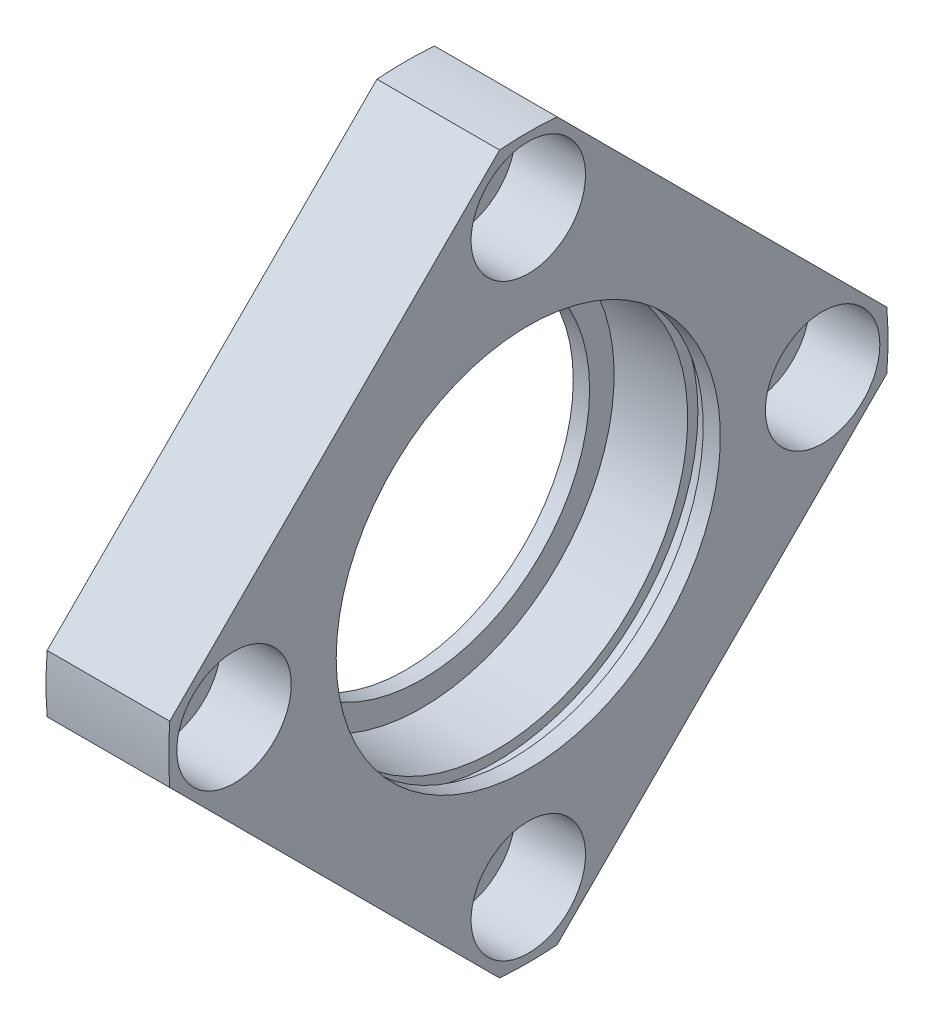
from build123d import *

# Parameters (mm, degrees)
DIAMETER_HOLE1_D     = 14
DIAMETER_HOLE1_DEPTH = 8.6
TAPPED_HOLE1_D       = 8.5
CUT_EXTRUDE1_DEPTH   = 65.007812023


with BuildPart() as part:
    # Sketch1 → Revolve1 (revolve)
    with BuildSketch(Plane.XY):
        Polygon((15, 44), (0, 44), (0, 20.5), (2, 20.5), (2, 23.5), (11, 23.5), (11, 24.75), (12.9, 24.75), (12.9, 23.5), (15, 23.5), align=None)
    revolve(axis=Axis((0, 0, 0), (1, 0, 0)))

    # Diameter Hole1
    with Locations(Plane(origin=(15, 0, 0), x_dir=(0, 0, -1), z_dir=(1, 0, 0))):
        with Locations((0, 36), (36, 0), (0, -36), (-36, 0)):
            Hole(DIAMETER_HOLE1_D / 2, depth=DIAMETER_HOLE1_DEPTH)

    # Tapped Hole1 (through all)
    with Locations(Plane(origin=(6.4, 0, 0), x_dir=(0, 0, -1), z_dir=(1, 0, 0))):
        with Locations((0, 36), (36, 0), (0, -36), (-36, 0)):
            Hole(TAPPED_HOLE1_D / 2)

    # Sketch6 → Cut-Extrude1 (cut, through all)
    with BuildSketch(Plane(origin=(0, 0, 0), x_dir=(0, 0, -1), z_dir=(1, 0, 0))):
        with BuildLine():
            Line((-3.516934416, 43.859219924), (-43.859219924, 3.516934416))
            ThreePointArc((-43.859219924, 3.516934416), (-31.112698372, 31.112698372), (-3.516934416, 43.859219924))
        make_face()
        with BuildLine():
            Line((3.516934416, 43.859219924), (43.859219924, 3.516934416))
            ThreePointArc((43.859219924, 3.516934416), (31.112698372, 31.112698372), (3.516934416, 43.859219924))
        make_face()
        with BuildLine():
            Line((43.859219924, -3.516934416), (3.516934416, -43.859219924))
            ThreePointArc((3.516934416, -43.859219924), (31.112698372, -31.112698372), (43.859219924, -3.516934416))
        make_face()
        with BuildLine():
            Line((-43.859219924, -3.516934416), (-3.516934416, -43.859219924))
            ThreePointArc((-3.516934416, -43.859219924), (-31.112698372, -31.112698372), (-43.859219924, -3.516934416))
        make_face()
    extrude(amount=CUT_EXTRUDE1_DEPTH, mode=Mode.SUBTRACT)


solid = part.part
